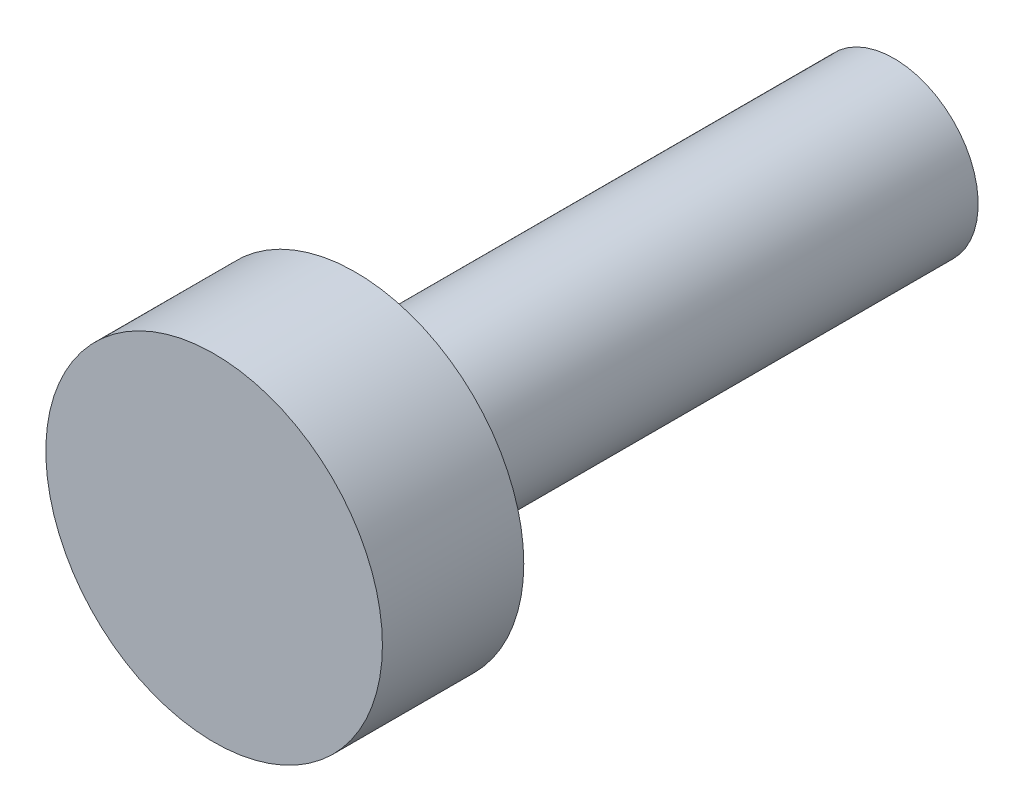
from build123d import *

# Parameters (mm, degrees)
ESQUISSE1_R        = 2.5
BOSS_EXTRU_1_DEPTH = 2.1
ESQUISSE2_R        = 1.25
BOSS_EXTRU_2_DEPTH = 8


with BuildPart() as part:
    # Esquisse1 → Boss.-Extru.1 (new body)
    with BuildSketch(Plane.XY):
        Circle(ESQUISSE1_R)
    extrude(amount=BOSS_EXTRU_1_DEPTH)

    # Esquisse2 → Boss.-Extru.2 (add)
    with BuildSketch(Plane(origin=(0, 0, 0), x_dir=(-1, 0, 0), z_dir=(0, 0, -1))):
        Circle(ESQUISSE2_R)
    extrude(amount=BOSS_EXTRU_2_DEPTH)


solid = part.part
